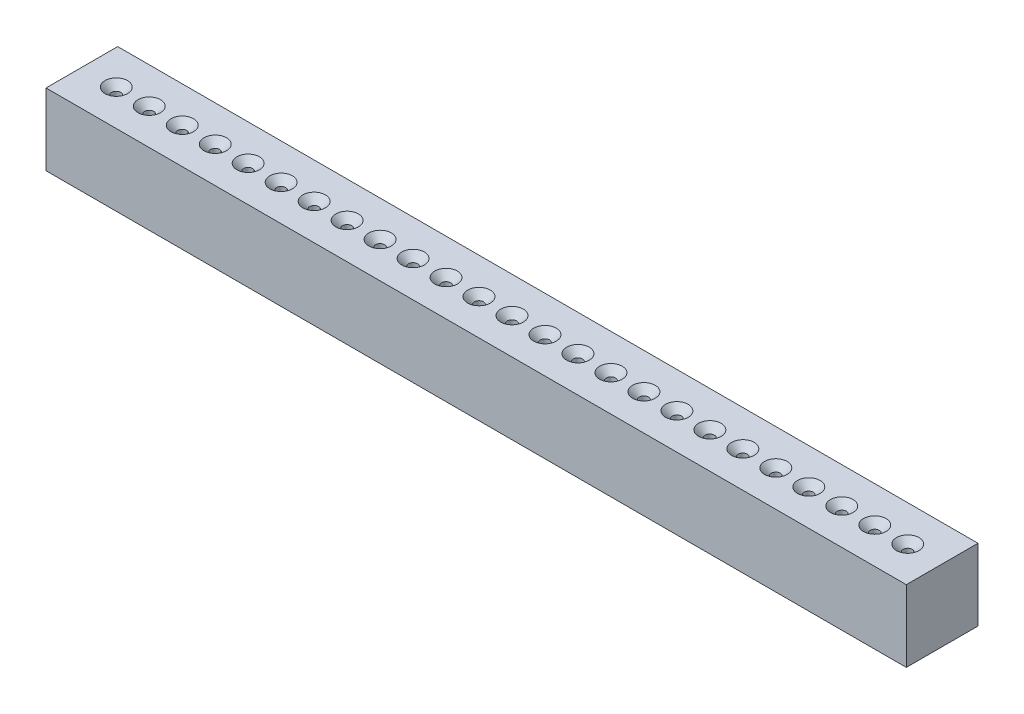
from build123d import *

# Parameters (mm, degrees)
SKETCH1_W                       = 152.4
SKETCH1_H                       = 12.7
BOSS_EXTRUDE1_DEPTH             = 12.7
M2X0_4_TAPPED_HOLE1_D           = 1.6
M2X0_4_TAPPED_HOLE1_DEPTH       = 2.9983176
M2X0_4_TAPPED_HOLE1_CSINK_D     = 4
M2X0_4_TAPPED_HOLE1_CSINK_ANGLE = 90
M2X0_4_TAPPED_HOLE1_TIP         = 0.480688495


with BuildPart() as part:
    # Sketch1 → Boss-Extrude1 (new body)
    with BuildSketch(Plane(origin=(0, 0, 0), x_dir=(1, 0, 0), z_dir=(0, 1, 0))):
        with Locations((76.2, 6.35)):
            Rectangle(SKETCH1_W, SKETCH1_H)
    extrude(amount=BOSS_EXTRUDE1_DEPTH)

    # M2x0.4 Tapped Hole1
    with Locations(Plane(origin=(0, 12.7, 0), x_dir=(1, 0, 0), z_dir=(0, 1, 0))):
        with Locations((6.096, 6.35), (11.938, 6.35), (17.78, 6.35), (23.622, 6.35), (29.464, 6.35), (35.306, 6.35), (41.148, 6.35), (46.99, 6.35), (52.832, 6.35), (58.674, 6.35), (64.516, 6.35), (70.358, 6.35), (76.2, 6.35), (82.042, 6.35), (87.884, 6.35), (93.726, 6.35), (99.568, 6.35), (105.41, 6.35), (111.252, 6.35), (117.094, 6.35), (122.936, 6.35), (128.778, 6.35), (134.62, 6.35), (140.462, 6.35), (146.304, 6.35)):
            CounterSinkHole(M2X0_4_TAPPED_HOLE1_D / 2, M2X0_4_TAPPED_HOLE1_CSINK_D / 2, depth=M2X0_4_TAPPED_HOLE1_DEPTH, counter_sink_angle=M2X0_4_TAPPED_HOLE1_CSINK_ANGLE)
            with Locations((0, 0, -(M2X0_4_TAPPED_HOLE1_DEPTH + M2X0_4_TAPPED_HOLE1_TIP / 2))):  # 118° drill point
                Cone(0, M2X0_4_TAPPED_HOLE1_D / 2, M2X0_4_TAPPED_HOLE1_TIP, mode=Mode.SUBTRACT)


solid = part.part
